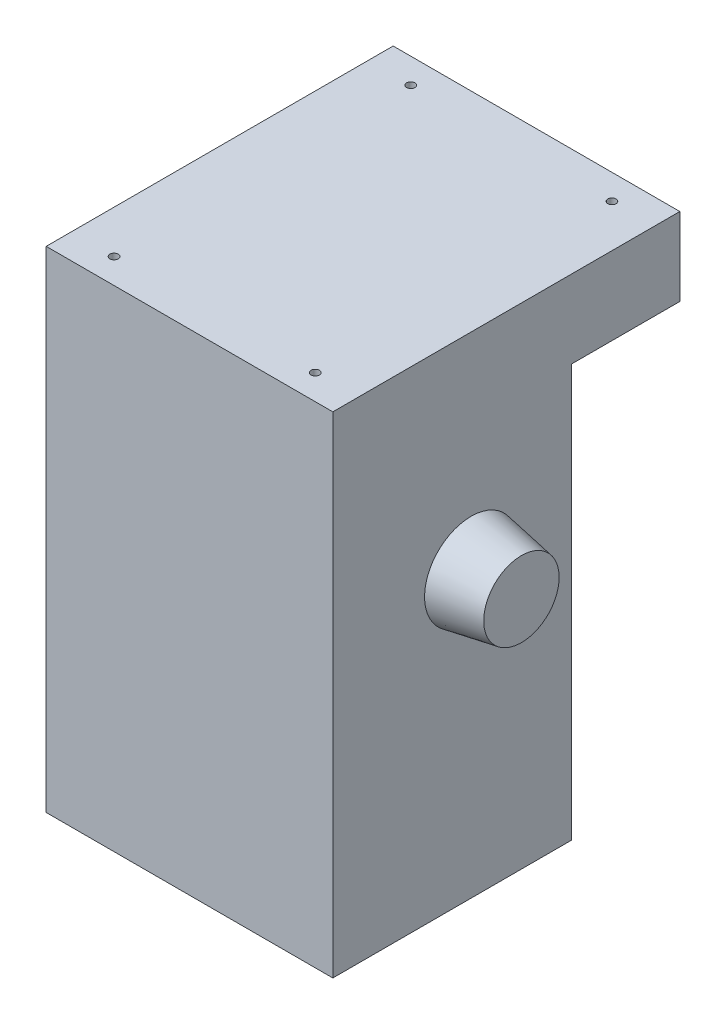
from build123d import *

# Parameters (mm, degrees)
SKETCH_1_W                  = 114
SKETCH_1_H                  = 95
EXTRUDE_1_DEPTH             = 164
SKETCH_2_W                  = 114
SKETCH_2_H                  = 138
EXTRUDE_2_DEPTH             = 31
PATTERN_LINEAR_1_COUNT      = 2
PATTERN_LINEAR_1_PITCH      = 118
PATTERN_LINEAR_1_COUNT_DIR2 = 2
PATTERN_LINEAR_1_PITCH_DIR2 = 80
SKETCH_6_R                  = 15
EXTRUDE_3_DEPTH             = 20
DRAFT_1_ANGLE               = 10


with BuildPart() as part:
    # 草图1 → 凸台-拉伸1 (new body)
    with BuildSketch(Plane(origin=(0, 0, 0), x_dir=(1, 0, 0), z_dir=(0, 1, 0))):
        Rectangle(SKETCH_1_W, SKETCH_1_H)
    extrude(amount=EXTRUDE_1_DEPTH)

    # 草图2 → 凸台-拉伸2 (add)
    with BuildSketch(Plane(origin=(0, 164, 0), x_dir=(1, 0, 0), z_dir=(0, 1, 0))):
        with Locations((0, 21.5)):
            Rectangle(SKETCH_2_W, SKETCH_2_H)
    extrude(amount=EXTRUDE_2_DEPTH)

    # 草图5 → M4 螺纹孔1 (revolve, cut)
    with BuildSketch(Plane(origin=(-40, 195, 37.5), x_dir=(0, 0, 1), z_dir=(1, 0, 0))):
        Polygon((0, 0), (0, 8.991420021), (1.65, 8), (1.65, 0), align=None)
    hole_wizard_m4_1 = revolve(axis=Axis((-40, 201.35, 37.5), (0, -1, 0)), mode=Mode.SUBTRACT)

    # 阵列(线性)1: Hole Wizard M4 _1 2 × 2
    with Locations(*[(j * PATTERN_LINEAR_1_PITCH_DIR2, 0, -i * PATTERN_LINEAR_1_PITCH) for i in range(PATTERN_LINEAR_1_COUNT) for j in range(PATTERN_LINEAR_1_COUNT_DIR2) if (i, j) != (0, 0)]):
        add(hole_wizard_m4_1, mode=Mode.SUBTRACT)

    # 草图6 → 凸台-拉伸3 (add)
    with BuildSketch(Plane(origin=(57, 0, 0), x_dir=(0, 0, -1), z_dir=(1, 0, 0))):
        with Locations((7.5, 113)):
            Circle(SKETCH_6_R)
    extrude(amount=EXTRUDE_3_DEPTH)

    # 拔模1
    draft_1_faces = [part.faces().sort_by_distance(p)[0] for p in [
        (67, 113, 7.5),
    ]]
    draft(draft_1_faces, Plane(origin=(77, 113, -7.5), x_dir=(0, 0, 1), z_dir=(1, 0, 0)), DRAFT_1_ANGLE)

    # 镜向1: part across plane


with BuildPart() as part_1:
    add(part.part)
    add(part.part.mirror(Plane(origin=(0, 0, 0), x_dir=(0, 0, 1), z_dir=(1, 0, 0))))


solid = part_1.part
